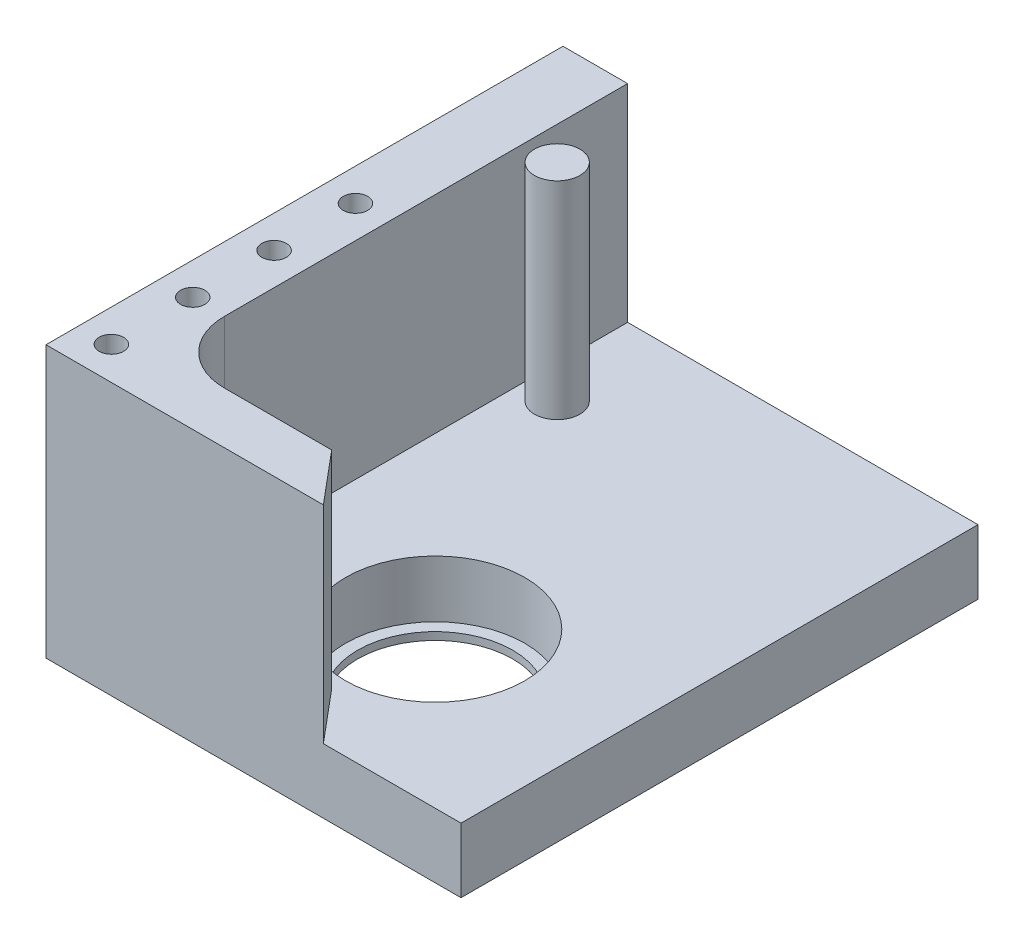
from build123d import *

# Parameters (mm, degrees)
SKETCH1_W            = 50.975
SKETCH1_H            = 38.1
BASE_DEPTH           = 7.9375
SKETCH2_R            = 11
BEARING_BORE_DEPTH   = 7
THRU_HOLE_DEPTH      = 36.191831439
THRU_HOLE_DEPTH_BACK = 36.191831439
SKETCH3_R            = 9.525
SKETCH4_W            = 7.9375
SKETCH4_H            = 38.1
VERTICAL_DEPTH       = 25.4
SKETCH7_W            = 6.35
SKETCH7_H            = 25.4
ARM_STOP_DEPTH       = 20.8026
ANGLED_FACE_REACH    = 49.967
FILLET1_R            = 7.62
SKETCH6_R            = 1.5
DOWEL_HOLES_DEPTH    = 7.007999954
SPRING_BASE_DEPTH    = 25.4
SKETCH12_R           = 2.794
SPRING_MOUNT_DEPTH   = 25.4


with BuildPart() as part:
    # Sketch1 → Base (new body)
    with BuildSketch(Plane(origin=(0, 0, 0), x_dir=(1, 0, 0), z_dir=(0, 1, 0))):
        with Locations((-3.2625, 0)):
            Rectangle(SKETCH1_W, SKETCH1_H)
    extrude(amount=BASE_DEPTH)

    # Sketch2 → Bearing Bore (cut)
    with BuildSketch(Plane(origin=(0, 7.9375, 0), x_dir=(1, 0, 0), z_dir=(0, 1, 0))):
        with Locations(Location((0, 0, 0), (0, 0, 270))):
            Circle(SKETCH2_R)
    extrude(amount=-BEARING_BORE_DEPTH, mode=Mode.SUBTRACT)

    # Sketch3 → Thru Hole (cut, two sides: drawn at the far end of the back side and taken through both)
    with BuildSketch(Plane(origin=(0, 0.9375, 0), x_dir=(1, 0, 0), z_dir=(0, 1, 0)).offset(-THRU_HOLE_DEPTH_BACK)):
        with Locations(Location((0, 0, 0), (0, 0, 270))):
            Circle(SKETCH3_R)
    extrude(amount=THRU_HOLE_DEPTH + THRU_HOLE_DEPTH_BACK, mode=Mode.SUBTRACT)

    # Sketch4 → Vertical (add)
    with BuildSketch(Plane(origin=(0, 7.9375, 0), x_dir=(1, 0, 0), z_dir=(0, 1, 0))):
        with Locations((-24.78125, 0)):
            Rectangle(SKETCH4_W, SKETCH4_H)
    extrude(amount=VERTICAL_DEPTH)

    # Sketch7 → Arm Stop (add)
    with BuildSketch(Plane(origin=(-20.8125, 0, 0), x_dir=(0, 0, -1), z_dir=(1, 0, 0))):
        with Locations((-15.875, 20.6375)):
            Rectangle(SKETCH7_W, SKETCH7_H)
    extrude(amount=ARM_STOP_DEPTH)

    # Sketch8 → Angled Face (add, up to next)
    with BuildSketch(Plane(origin=(0, 33.3375, 0), x_dir=(1, 0, 0), z_dir=(0, 1, 0)), mode=Mode.PRIVATE) as angled_face_sk1:
        Polygon((-0.0099, -12.7), (5.318382658, -19.05), (-0.0099, -19.05), align=None)
    angled_face_tool1 = extrude(angled_face_sk1.sketch, amount=-ANGLED_FACE_REACH, mode=Mode.PRIVATE) - part.part
    add(angled_face_tool1.solids().sort_by_distance((1.766194, 33.3375, 16.933333))[0])

    # Fillet1
    fillet1_edges = [part.edges().sort_by_distance(p)[0] for p in [
        (-20.8125, 20.6375, 12.7),
    ]]
    fillet(fillet1_edges, radius=FILLET1_R)

    # Sketch6 → Dowel Holes (cut)
    with BuildSketch(Plane(origin=(0, 33.3375, 0), x_dir=(1, 0, 0), z_dir=(0, 1, 0))):
        with Locations(Location((-24.78125, 14.990388599, 0), (0, 0, 270))):
            Circle(SKETCH6_R)
        with Locations(Location((-24.78125, 4.9967962, 0), (0, 0, 270))):
            Circle(SKETCH6_R)
        with Locations(Location((-24.78125, -14.990388599, 0), (0, 0, 270))):
            Circle(SKETCH6_R)
        with Locations(Location((-24.78125, -4.9967962, 0), (0, 0, 270))):
            Circle(SKETCH6_R)
    extrude(amount=-DOWEL_HOLES_DEPTH, mode=Mode.SUBTRACT)

    # Sketch11 → Spring Base (add)
    with BuildSketch(Plane(origin=(0, 0, -19.05), x_dir=(-1, 0, 0), z_dir=(0, 0, -1))):
        Polygon((-22.225, 7.9375), (20.8125, 7.9375), (20.8125, 33.3375), (28.75, 33.3375), (28.75, 0), (-22.225, 0), align=None)
    extrude(amount=SPRING_BASE_DEPTH)

    # Sketch12 → Spring Mount (add)
    with BuildSketch(Plane(origin=(0, 7.9375, 0), x_dir=(1, 0, 0), z_dir=(0, 1, 0))):
        with Locations(Location((-16.7612, 31.75, 0), (0, 0, 270))):
            Circle(SKETCH12_R)
    extrude(amount=SPRING_MOUNT_DEPTH)


solid = part.part
